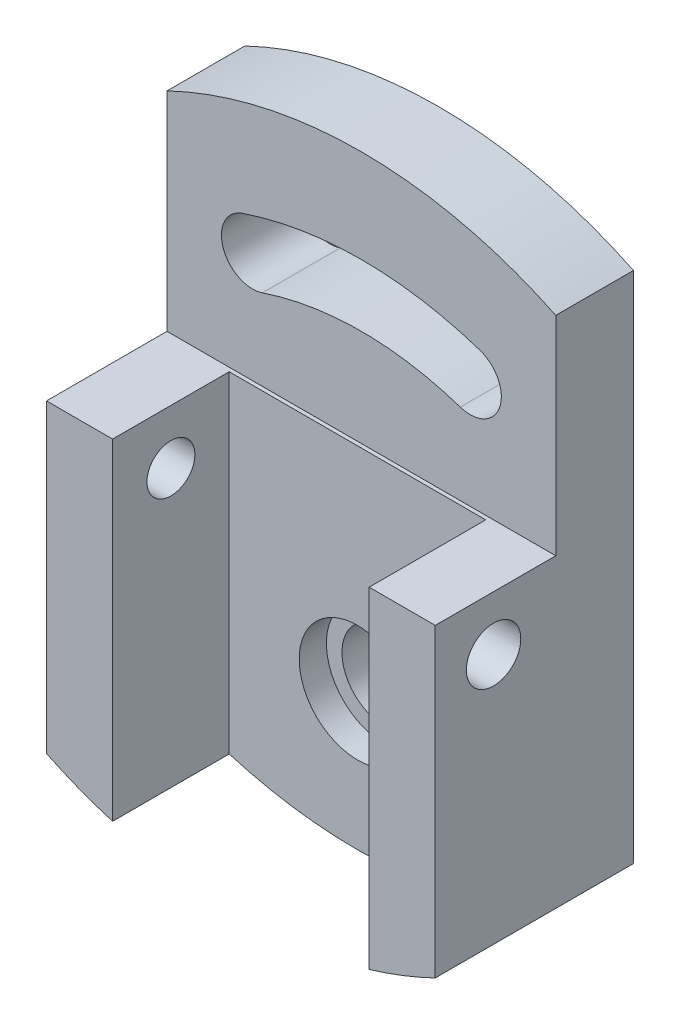
from build123d import *

# Parameters (mm, degrees)
BOSS_EXTRUDE1_DEPTH = 20
BOSS_EXTRUDE2_DEPTH = 31
SKETCH8_R           = 15
SKETCH8_R_2         = 11
CUT_EXTRUDE4_DEPTH  = 6
SKETCH8_2_R         = 11
CUT_EXTRUDE5_DEPTH  = 134.645052284
SKETCH10_R          = 6
SKETCH9_R           = 7
CUT_EXTRUDE6_DEPTH  = 134.645052321
SKETCH12_R          = 15
BOSS_EXTRUDE3_DEPTH = 1


with BuildPart() as part:
    # Sketch1 → Boss-Extrude1 (new body)
    with BuildSketch(Plane.XY):
        with BuildLine():
            ThreePointArc((50, 108.561575886), (0, 120), (-50, 108.561575886))
            Line((-50, 108.561575886), (-50, -23.561575886))
            ThreePointArc((-50, -23.561575886), (0, -35), (50, -23.561575886))
            Line((50, -23.561575886), (50, 108.561575886))
        make_face()
    extrude(amount=BOSS_EXTRUDE1_DEPTH)

    # Sketch2 → Boss-Extrude2 (add)
    with BuildSketch(Plane.XY.offset(20)):
        with BuildLine():
            Line((-50, 55), (-50, -23.561575886))
            ThreePointArc((-50, -23.561575886), (-41.631074926, -27.200063435), (-33, -30.163514831))
            Line((-33, -30.163514831), (-33, 55))
            Line((-33, 55), (-50, 55))
        make_face()
        with BuildLine():
            Line((33, 55), (33, -30.163514831))
            ThreePointArc((33, -30.163514831), (41.631074926, -27.200063435), (50, -23.561575886))
            Line((50, -23.561575886), (50, 55))
            Line((50, 55), (33, 55))
        make_face()
    extrude(amount=BOSS_EXTRUDE2_DEPTH)

    # Sketch8 → Cut-Extrude4 (cut)
    with BuildSketch(Plane.XY.offset(20)):
        Circle(SKETCH8_R)
        Circle(SKETCH8_R_2, mode=Mode.SUBTRACT)
    extrude(amount=-CUT_EXTRUDE4_DEPTH, mode=Mode.SUBTRACT)

    # Sketch8<2> → Cut-Extrude5 (cut, through all)
    with BuildSketch(Plane.XY.offset(20)):
        Circle(SKETCH8_2_R)
    extrude(amount=-CUT_EXTRUDE5_DEPTH, mode=Mode.SUBTRACT)

    # Sketch10 → Cut-Loft1 section 0
    with BuildSketch(Plane.ZY.offset(50)):
        with Locations((36, 41)):
            Circle(SKETCH10_R)
    # Sketch9 → Cut-Loft1 section 1
    with BuildSketch(Plane(origin=(50, 0, 0), x_dir=(0, 0, -1), z_dir=(1, 0, 0))):
        with Locations((-36, 41)):
            Circle(SKETCH9_R)
    loft(mode=Mode.SUBTRACT)

    # Sketch11 → Cut-Extrude6 (cut, through all)
    with BuildSketch(Plane.XY.offset(20)):
        with BuildLine():
            ThreePointArc((30.545454545, 91.010852136), (0, 96), (-30.545454545, 91.010852136))
            ThreePointArc((-30.545454545, 91.010852136), (-35.584237678, 80.881159913), (-25.454545455, 75.84237678))
            ThreePointArc((-25.454545455, 75.84237678), (0, 80), (25.454545455, 75.84237678))
            ThreePointArc((25.454545455, 75.84237678), (35.584237678, 80.881159913), (30.545454545, 91.010852136))
        make_face()
    extrude(amount=-CUT_EXTRUDE6_DEPTH, mode=Mode.SUBTRACT)

    # Sketch12 → Boss-Extrude3 (add)
    with BuildSketch(Plane.XY.offset(20)):
        with BuildLine():
            Line((-33, 55), (-33, -30.163514831))
            ThreePointArc((-33, -30.163514831), (0, -35), (33, -30.163514831))
            Line((33, -30.163514831), (33, 55))
            Line((33, 55), (-33, 55))
        make_face()
        Circle(SKETCH12_R, mode=Mode.SUBTRACT)
    extrude(amount=BOSS_EXTRUDE3_DEPTH)


solid = part.part
